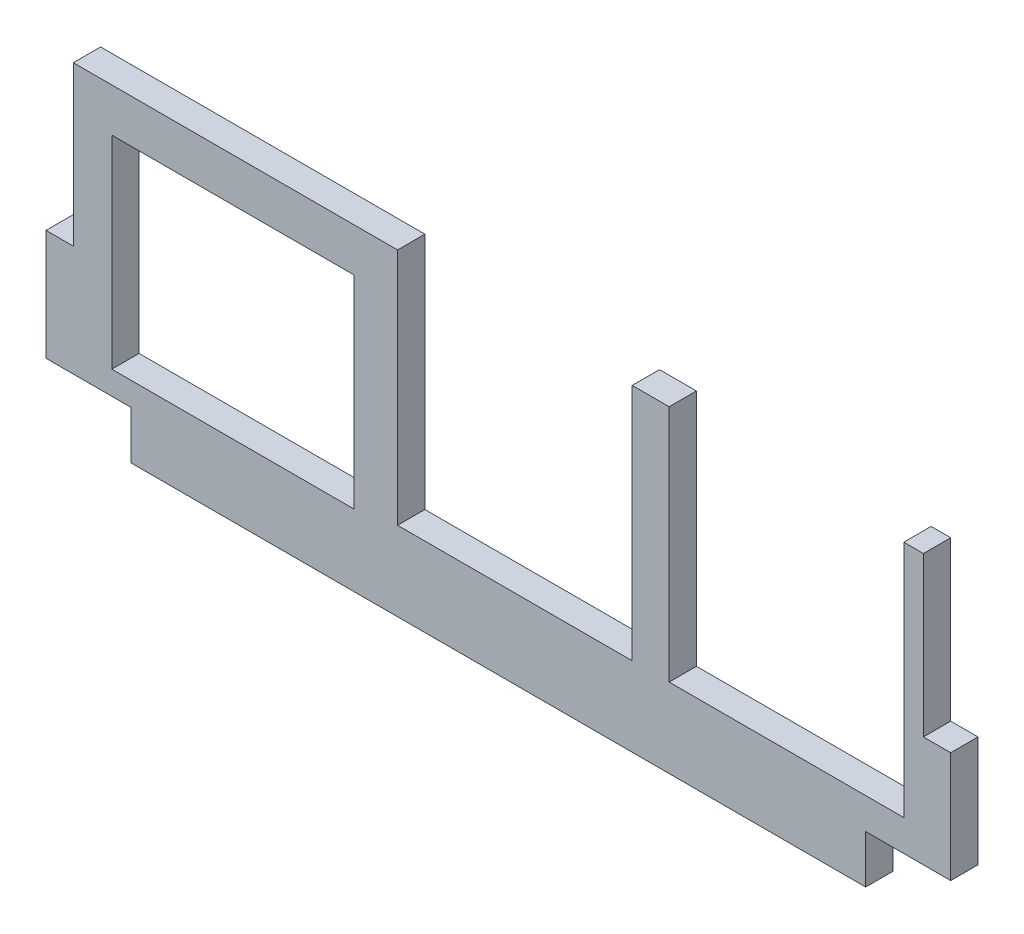
from build123d import *

# Parameters (mm, degrees)
BOSS_EXTRUDE1_DEPTH = 1.8034
SKETCH2_W           = 18.542
SKETCH2_H           = 2.8702
BOSS_EXTRUDE2_DEPTH = 1.8034


with BuildPart() as part:
    # Sketch1 → Boss-Extrude1 (new body)
    with BuildSketch(Plane.XY):
        Polygon((-1.8034, 12.0396), (0, 12.0396), (0, 19.6596), (2.54, 19.6596), (2.54, 6.2738), (18.542, 6.2738), (18.542, 22.5298), (21.4122, 22.5298), (21.4122, 6.7818), (36.9062, 6.7818), (36.9062, 22.5298), (39.3446, 22.5298), (39.3446, 6.7818), (54.8386, 6.7818), (54.8386, 22.5298), (56.134, 22.5298), (56.134, 12.0396), (57.9374, 12.0396), (57.9374, 4.7244), (52.324, 4.7244), (52.324, 1.5494), (3.81, 1.5494), (3.81, 4.7244), (-1.8034, 4.7244), align=None)
    extrude(amount=BOSS_EXTRUDE1_DEPTH)

    # Sketch2 → Boss-Extrude2 (add)
    with BuildSketch(Plane.XY.offset(1.8034)):
        with Locations((9.271, 21.0947)):
            Rectangle(SKETCH2_W, SKETCH2_H)
    extrude(amount=-BOSS_EXTRUDE2_DEPTH)


solid = part.part
